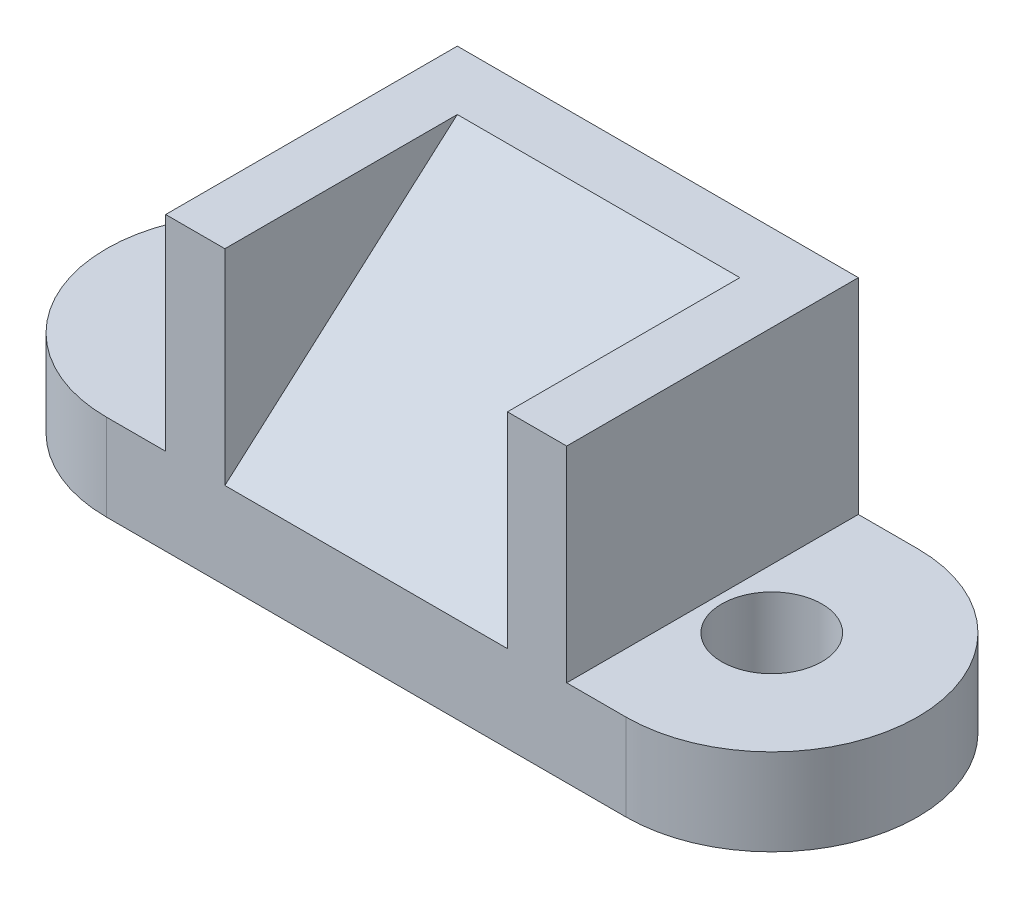
from build123d import *

# Parameters (mm, degrees)
BOSS_EXTRUDE2_DEPTH = 64
CUT_EXTRUDE3_START  = -45
CUT_EXTRUDE3_DEPTH  = 45
SKETCH7_R           = 11
CUT_EXTRUDE5_DEPTH  = 96
SKETCH8_R           = 11
CUT_EXTRUDE6_DEPTH  = 105
CUT_EXTRUDE7_START  = -45
CUT_EXTRUDE7_DEPTH  = 45
SKETCH10_W          = 13
SKETCH10_H          = 64
CUT_EXTRUDE8_DEPTH  = 45
SKETCH11_W          = 13
SKETCH11_H          = 64
CUT_EXTRUDE9_DEPTH  = 45
CUT_EXTRUDE12_DEPTH = 31
CUT_EXTRUDE13_DEPTH = 31


with BuildPart() as part:
    # Sketch1 → Boss-Extrude2 (new body)
    with BuildSketch(Plane(origin=(0, 0, 0), x_dir=(1, 0, 0), z_dir=(0, 1, 0))):
        with BuildLine():
            Line((0, -32), (114, -32))
            ThreePointArc((114, -32), (146, 0), (114, 32))
            Line((114, 32), (0, 32))
            ThreePointArc((0, 32), (-32, 0), (0, -32))
        make_face()
    extrude(amount=BOSS_EXTRUDE2_DEPTH)

    # Sketch6 → Cut-Extrude3 (cut)
    with BuildSketch(Plane(origin=(0, 64, 0), x_dir=(1, 0, 0), z_dir=(0, 1, 0)).offset(CUT_EXTRUDE3_START)):
        with BuildLine():
            Line((0, 32), (0, -32))
            ThreePointArc((0, -32), (-32, 0), (0, 32))
        make_face()
    extrude(amount=CUT_EXTRUDE3_DEPTH, mode=Mode.SUBTRACT)

    # Sketch7 → Cut-Extrude5 (cut)
    with BuildSketch(Plane(origin=(0, 64, 0), x_dir=(1, 0, 0), z_dir=(0, 1, 0))):
        with Locations(Location((0, 0, 0), (0, 0, 270))):
            Circle(SKETCH7_R)
    extrude(amount=-CUT_EXTRUDE5_DEPTH, mode=Mode.SUBTRACT)

    # Sketch8 → Cut-Extrude6 (cut)
    with BuildSketch(Plane(origin=(0, 64, 0), x_dir=(1, 0, 0), z_dir=(0, 1, 0))):
        with Locations(Location((114, 0, 0), (0, 0, 270))):
            Circle(SKETCH8_R)
    extrude(amount=-CUT_EXTRUDE6_DEPTH, mode=Mode.SUBTRACT)

    # Sketch9 → Cut-Extrude7 (cut)
    with BuildSketch(Plane(origin=(0, 64, 0), x_dir=(1, 0, 0), z_dir=(0, 1, 0)).offset(CUT_EXTRUDE7_START)):
        with BuildLine():
            Line((114, 32), (114, -32))
            ThreePointArc((114, -32), (146, 0), (114, 32))
        make_face()
    extrude(amount=CUT_EXTRUDE7_DEPTH, mode=Mode.SUBTRACT)

    # Sketch10 → Cut-Extrude8 (cut)
    with BuildSketch(Plane(origin=(0, 64, 0), x_dir=(1, 0, 0), z_dir=(0, 1, 0))):
        with Locations((6.5, 0)):
            Rectangle(SKETCH10_W, SKETCH10_H)
    extrude(amount=-CUT_EXTRUDE8_DEPTH, mode=Mode.SUBTRACT)

    # Sketch11 → Cut-Extrude9 (cut)
    with BuildSketch(Plane(origin=(0, 64, 0), x_dir=(1, 0, 0), z_dir=(0, 1, 0))):
        with Locations((107.5, 0)):
            Rectangle(SKETCH11_W, SKETCH11_H)
    extrude(amount=-CUT_EXTRUDE9_DEPTH, mode=Mode.SUBTRACT)

    # Sketch15 → Cut-Extrude12 (cut)
    with BuildSketch(Plane.ZY.offset(-57)):
        Polygon((-19, 64), (32, 19), (32, 64), align=None)
    extrude(amount=-CUT_EXTRUDE12_DEPTH, mode=Mode.SUBTRACT)

    # Sketch16 → Cut-Extrude13 (cut)
    with BuildSketch(Plane(origin=(57, 0, 0), x_dir=(0, 0, -1), z_dir=(1, 0, 0))):
        Polygon((-32, 64), (19, 64), (-32, 19), align=None)
    extrude(amount=-CUT_EXTRUDE13_DEPTH, mode=Mode.SUBTRACT)


solid = part.part
